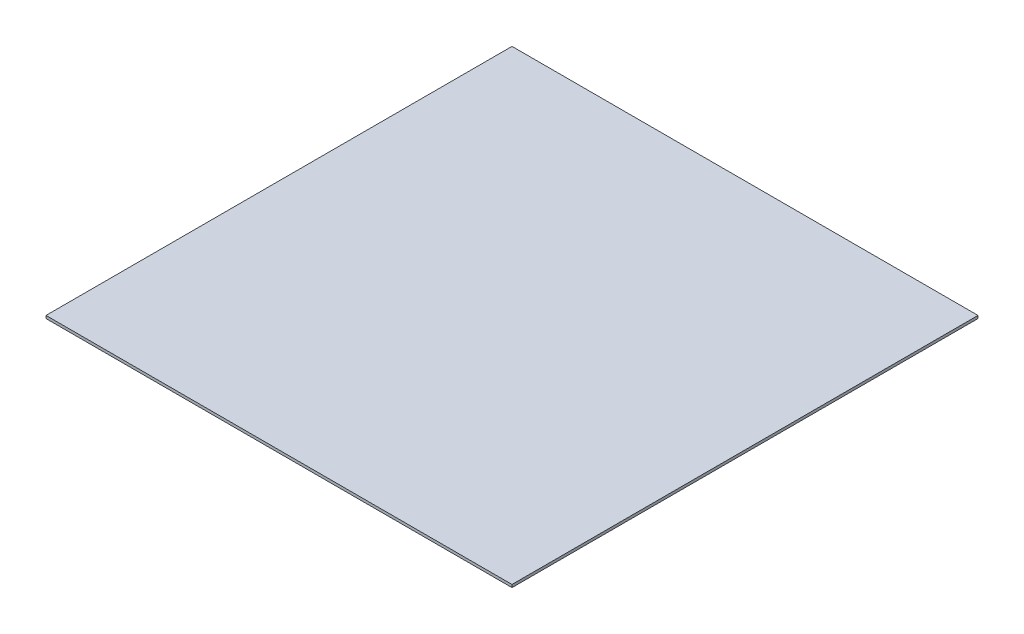
from build123d import *

# Parameters (mm, degrees)
SKETCH1_W           = 508
SKETCH1_H           = 508
BOSS_EXTRUDE1_DEPTH = 3


with BuildPart() as part:
    # Sketch1 → Boss-Extrude1 (new body)
    with BuildSketch(Plane(origin=(0, 0, 0), x_dir=(1, 0, 0), z_dir=(0, 1, 0))):
        Rectangle(SKETCH1_W, SKETCH1_H)
    extrude(amount=BOSS_EXTRUDE1_DEPTH)


solid = part.part
